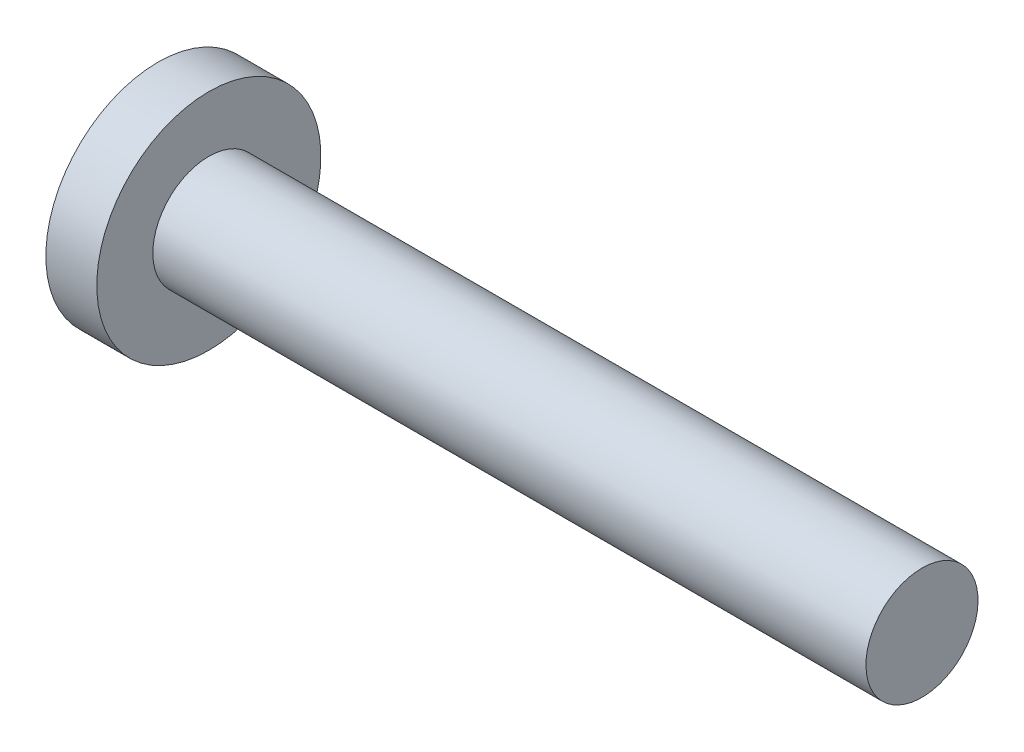
from build123d import *


with BuildPart() as part:
    # Sketch4 → Revolve1 (revolve)
    with BuildSketch(Plane.XY):
        Polygon((0, 0), (0, 22), (10, 22), (10, 11), (150, 11), (150, 0), align=None)
    revolve(axis=Axis((150, 0, 0), (-1, 0, 0)))


solid = part.part
